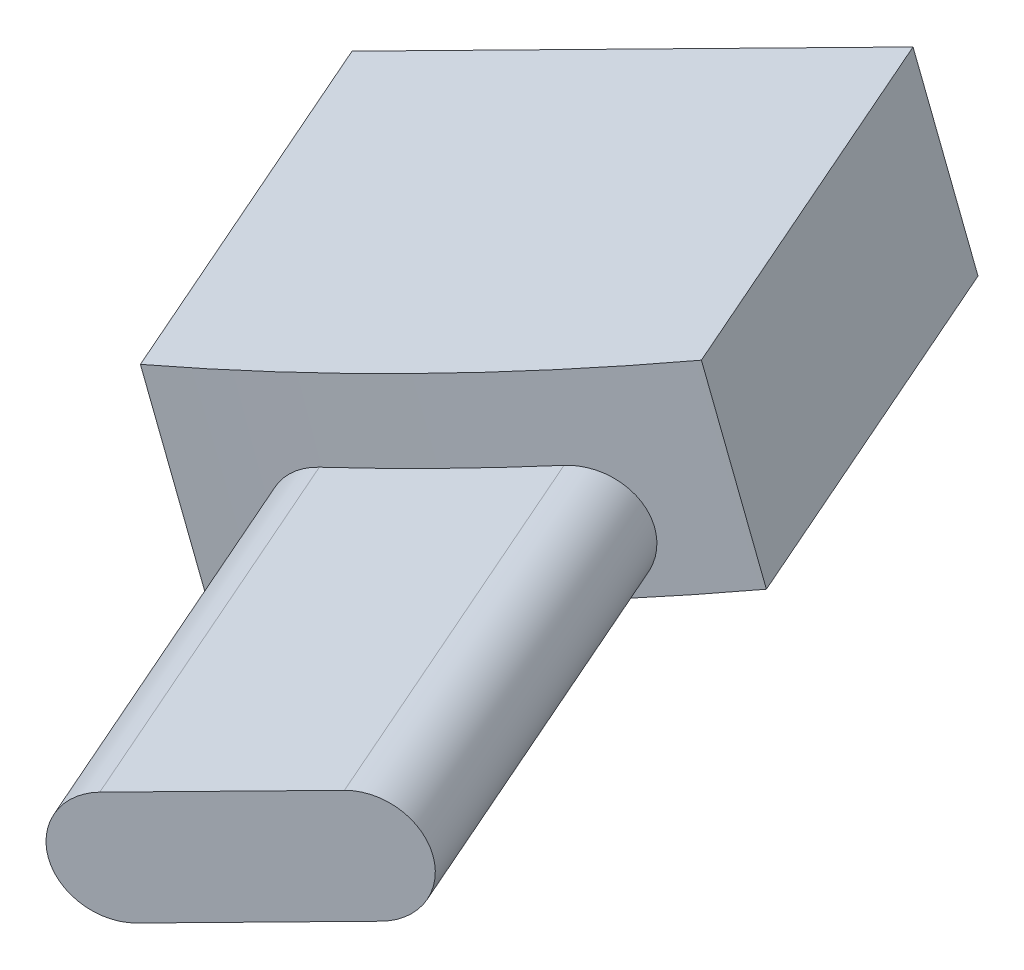
from build123d import *

# Parameters (mm, degrees)
BOSS_EXTRUDE1_DEPTH = 7
BOSS_EXTRUDE2_DEPTH = 31


with BuildPart() as part:
    # Sketch2 → Boss-Extrude1 (new body)
    with BuildSketch(Plane(origin=(-7.607664395, 31.287005672, 3.337829853), x_dir=(0.971914021301819, 0.23501337979879552, 0.0123226016926005), z_dir=(-0.23501337979879552, 0.9665075330997785, 0.10311110404281207))):
        with BuildLine():
            Line((8.938687007, -72.653651109), (-5.758907082, -79.102156982))
            Line((-5.758907082, -79.102156982), (0.267733921, -92.838226224))
            ThreePointArc((0.267733921, -92.838226224), (7.833125922, -90.10764187), (14.96532801, -86.389720351))
            Line((14.96532801, -86.389720351), (8.938687007, -72.653651109))
        make_face()
    extrude(amount=-BOSS_EXTRUDE1_DEPTH)

    # Sketch4 → Boss-Extrude2 (add)
    with BuildSketch(Plane(origin=(28.173765631, 2.9e-08, 64.214343511), x_dir=(-0.9157379494904142, 6.021465183735281e-11, 0.4017760668122129), z_dir=(-0.40177606681221284, -4.1173746889623063e-10, -0.9157379494904141))):
        with BuildLine():
            Line((32.238376721, 21.932158606), (39.003929453, 20.135690895))
            ThreePointArc((39.003929453, 20.135690895), (40.42366803, 17.68939934), (37.977376475, 16.269660762))
            Line((37.977376475, 16.269660762), (31.211823744, 18.066128473))
            ThreePointArc((31.211823744, 18.066128473), (29.792085166, 20.512420028), (32.238376721, 21.932158606))
        make_face()
    extrude(amount=-BOSS_EXTRUDE2_DEPTH)


solid = part.part
